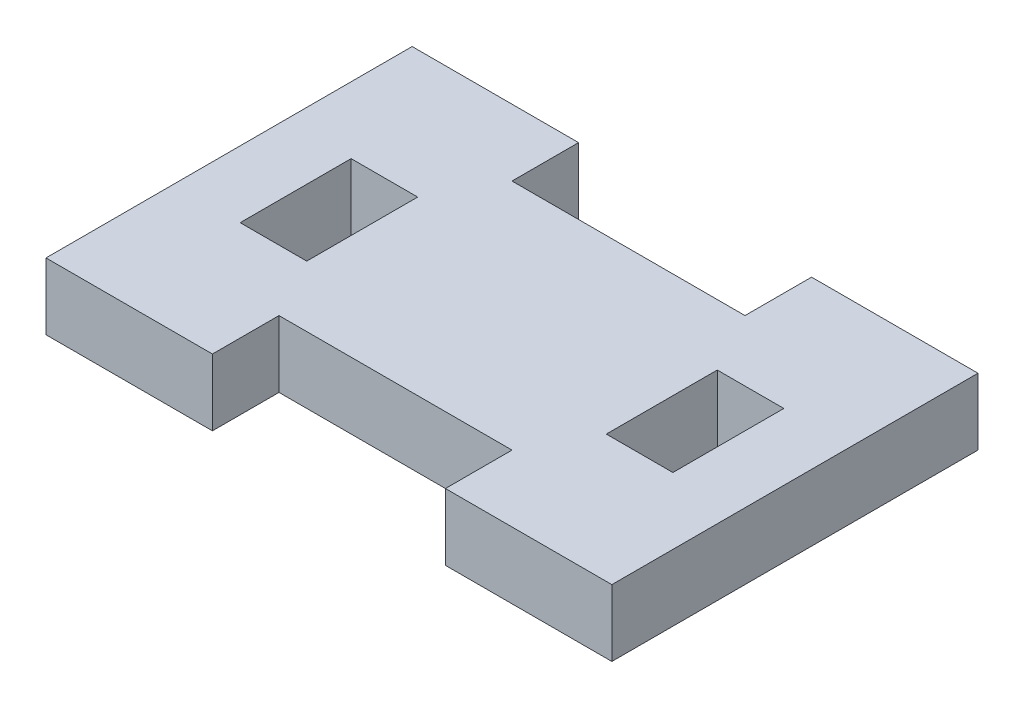
from build123d import *

# Parameters (mm, degrees)
EXTRUDE_1_DEPTH = 3


with BuildPart() as part:
    # 草图1 → 凸台-拉伸1 (new body)
    with BuildSketch(Plane(origin=(0, 0, 0), x_dir=(1, 0, 0), z_dir=(0, 1, 0))):
        Polygon((3, -8.25), (0, -8.25), (0, -16.5), (7.5, -16.5), (7.5, -13.5), (12.75, -13.5), (12.75, -8.25), (6, -8.25), (6, -10.75), (3, -10.75), align=None)
        Polygon((0, 0), (0, -8.25), (3, -8.25), (3, -5.75), (6, -5.75), (6, -8.25), (12.75, -8.25), (12.75, -3), (7.5, -3), (7.5, 0), align=None)
        Polygon((12.75, -3), (12.75, -8.25), (19.5, -8.25), (19.5, -5.75), (22.5, -5.75), (22.5, -8.25), (25.5, -8.25), (25.5, 0), (18, 0), (18, -3), align=None)
        Polygon((19.5, -8.25), (12.75, -8.25), (12.75, -13.5), (18, -13.5), (18, -16.5), (25.5, -16.5), (25.5, -8.25), (22.5, -8.25), (22.5, -10.75), (19.5, -10.75), align=None)
    extrude(amount=EXTRUDE_1_DEPTH)


solid = part.part
